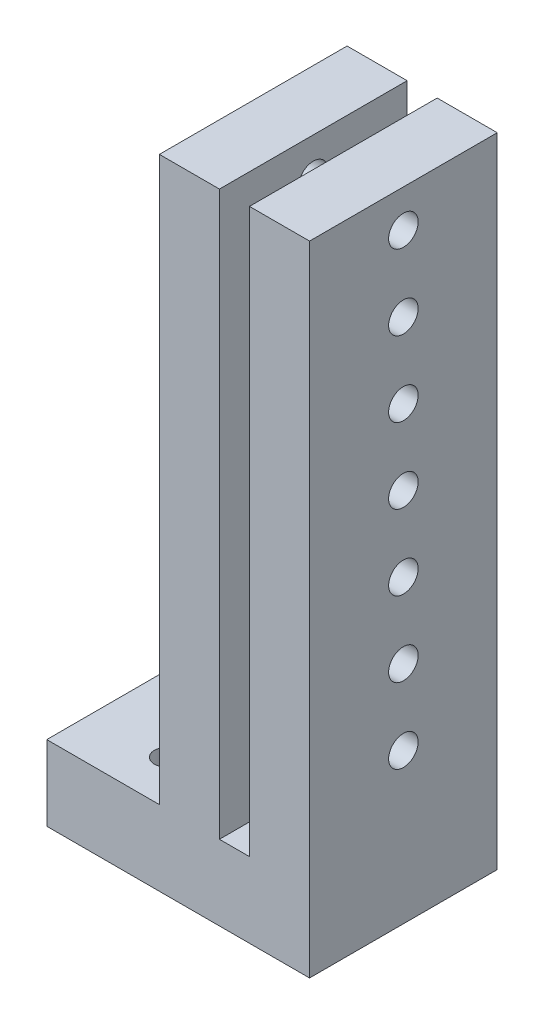
from build123d import *

# Parameters (mm, degrees)
SKETCH1_W           = 50
SKETCH1_H           = 25
BOSS_EXTRUDE1_DEPTH = 10
SKETCH2_W           = 20
SKETCH2_H           = 25
BOSS_EXTRUDE2_DEPTH = 75
SKETCH3_W           = 4
SKETCH3_H           = 25
CUT_EXTRUDE1_DEPTH  = 75
SKETCH4_R           = 1.966955022
CUT_EXTRUDE2_DEPTH  = 96.262794416
LPATTERN1_COUNT     = 7
LPATTERN1_PITCH     = 10
SKETCH5_W           = 15
SKETCH5_H           = 25
CUT_EXTRUDE3_DEPTH  = 94.541434669
SKETCH6_R           = 1.6
CUT_EXTRUDE4_DEPTH  = 96.262794416


with BuildPart() as part:
    # Sketch1 → Boss-Extrude1 (new body)
    with BuildSketch(Plane(origin=(0, 0, 0), x_dir=(1, 0, 0), z_dir=(0, 1, 0))):
        with Locations((25, 12.5)):
            Rectangle(SKETCH1_W, SKETCH1_H)
    extrude(amount=BOSS_EXTRUDE1_DEPTH)

    # Sketch2 → Boss-Extrude2 (add)
    with BuildSketch(Plane(origin=(0, 10, 0), x_dir=(1, 0, 0), z_dir=(0, 1, 0))):
        with Locations((25, 12.5)):
            Rectangle(SKETCH2_W, SKETCH2_H)
    extrude(amount=BOSS_EXTRUDE2_DEPTH)

    # Sketch3 → Cut-Extrude1 (cut)
    with BuildSketch(Plane(origin=(0, 85, 0), x_dir=(1, 0, 0), z_dir=(0, 1, 0))):
        with Locations((25, 12.5)):
            Rectangle(SKETCH3_W, SKETCH3_H)
    extrude(amount=-CUT_EXTRUDE1_DEPTH, mode=Mode.SUBTRACT)

    # Sketch4 → Cut-Extrude2 (cut, through all)
    with BuildSketch(Plane.ZY.offset(-15)):
        with Locations((-12.5, 80)):
            Circle(SKETCH4_R)
    cut_extrude2 = extrude(amount=-CUT_EXTRUDE2_DEPTH, mode=Mode.SUBTRACT)

    # LPattern1: Cut-Extrude2 ×7
    with Locations(*[(0, -i * LPATTERN1_PITCH, 0) for i in range(1, LPATTERN1_COUNT)]):
        add(cut_extrude2, mode=Mode.SUBTRACT)

    # Sketch5 → Cut-Extrude3 (cut, through all)
    with BuildSketch(Plane(origin=(0, 10, 0), x_dir=(1, 0, 0), z_dir=(0, 1, 0))):
        with Locations((42.5, 12.5)):
            Rectangle(SKETCH5_W, SKETCH5_H)
    extrude(amount=-CUT_EXTRUDE3_DEPTH, mode=Mode.SUBTRACT)

    # Sketch6 → Cut-Extrude4 (cut, through all)
    with BuildSketch(Plane.XZ):
        with Locations(Location((10.000440006, -19.069369087, 0), (0, 0, 270))):
            Circle(SKETCH6_R)
    cut_extrude4 = extrude(amount=-CUT_EXTRUDE4_DEPTH, mode=Mode.SUBTRACT)

    # Mirror1: Cut-Extrude4 across plane
    add(cut_extrude4.mirror(Plane.XY.offset(-12.5)), mode=Mode.SUBTRACT)


solid = part.part
